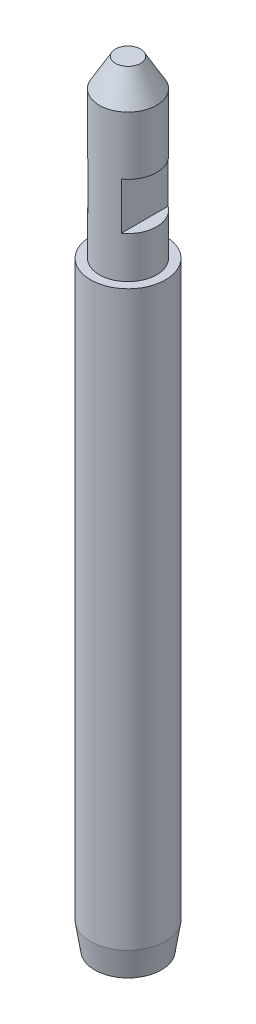
from build123d import *

# Parameters (mm, degrees)
ESQUISSE4_R             = 1.6
ENL_V_MAT_EXTRU_1_DEPTH = 10
ESQUISSE6_W             = 2.893423418
ESQUISSE6_H             = 5.635783234
ENL_V_MAT_EXTRU_3_DEPTH = 5.5


with BuildPart() as part:
    # Esquisse2 → Révolution1 (revolve)
    with BuildSketch(Plane.XY, mode=Mode.PRIVATE) as r_volution1_sk:
        Polygon((-100.191044353, 30), (-104.196152423, 30), (-104.691044353, 33.218828512), (-104.691044353, 102), (-103.641044353, 102), (-103.641044353, 119.622500925), (-101.691044353, 123), (-100.191044353, 123), align=None)
    revolve(r_volution1_sk.sketch.rotate(Axis((-100.191044353, 30, 0), (0, 1, 0)), 270), axis=Axis((-100.191044353, 30, 0), (0, 1, 0)))

    # Esquisse4 → Enlèv. mat.-Extru.1 (cut)
    with BuildSketch(Plane.XZ.offset(-30)):
        with Locations(Location((-100.191044353, 0, 0), (0, 0, 270))):
            Circle(ESQUISSE4_R)
    extrude(amount=-ENL_V_MAT_EXTRU_1_DEPTH, mode=Mode.SUBTRACT)

    # Esquisse6 → Enlèv. mat.-Extru.3 (cut, symmetric)
    with BuildSketch(Plane.XY):
        with Locations((-103.637756062, 109.817891617)):
            Rectangle(ESQUISSE6_W, ESQUISSE6_H)
        with Locations((-96.744332644, 109.817891617)):
            Rectangle(ESQUISSE6_W, ESQUISSE6_H)
    extrude(amount=ENL_V_MAT_EXTRU_3_DEPTH, both=True, mode=Mode.SUBTRACT)


solid = part.part
